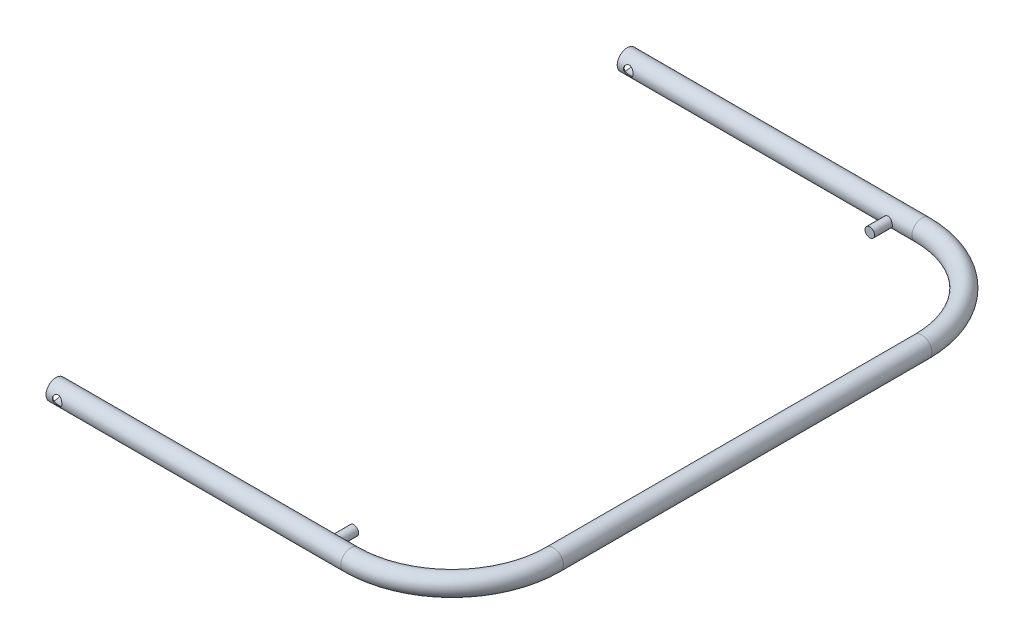
from build123d import *

# Parameters (mm, degrees)
SKETCH2_R                = 13.5
SKETCH2_R_2              = 12.5
SKETCH11_R               = 6.5
CUT_EXTRUDE1_DEPTH       = 516.5
BOSS_EXTRUDE1_REACH      = 933.549
BOSS_EXTRUDE1_END_RADIUS = 13.5
SKETCH12_R               = 6.5
BOSS_EXTRUDE2_REACH      = 933.549
BOSS_EXTRUDE2_END_RADIUS = 13.5
SKETCH13_R               = 6.5


with BuildPart() as part:
    # Sweep-Thin1: sweep along a path in Sketch1
    with BuildLine(Plane(origin=(0, 0, 0), x_dir=(1, 0, 0), z_dir=(0, 1, 0))) as sweep_thin1_path:
        Line((0, 400), (400, 400))
        ThreePointArc((400, 400), (506.066017178, 356.066017178), (550, 250))
        Line((550, 250), (550, -250))
        ThreePointArc((550, -250), (506.066017178, -356.066017178), (400, -400))
        Line((400, -400), (0, -400))
    # Sketch2 → Sweep-Thin1 (sweep)
    with BuildSketch(Plane(origin=(0, 0, -400), x_dir=(0, 0, -1), z_dir=(1, 0, 0))):
        with Locations((-12.5, 0)):
            Circle(SKETCH2_R)
        with Locations((-12.5, 0)):
            Circle(SKETCH2_R_2, mode=Mode.SUBTRACT)
    sweep(path=sweep_thin1_path.line)

    # Sketch11 → Cut-Extrude1 (cut, symmetric)
    with BuildSketch(Plane.XY):
        with Locations((15, 0)):
            Circle(SKETCH11_R)
    extrude(amount=CUT_EXTRUDE1_DEPTH, both=True, mode=Mode.SUBTRACT)

    # Boss-Extrude1: up to this cylinder (the profile starts outside it)
    boss_extrude1_end = Plane(origin=(366.731062, 0, -387.5), z_dir=(1, 0, 0)) * Cylinder(BOSS_EXTRUDE1_END_RADIUS, 1895.098, mode=Mode.PRIVATE)
    # Sketch12 → Boss-Extrude1 (add, up to the surface)
    with BuildSketch(Plane.XY.offset(-350), mode=Mode.PRIVATE) as boss_extrude1_sk1:
        with Locations((366.731061819, -1.317670837)):
            Circle(SKETCH12_R)
    boss_extrude1_tool1 = extrude(boss_extrude1_sk1.sketch, amount=-BOSS_EXTRUDE1_REACH, mode=Mode.PRIVATE) - boss_extrude1_end
    add(boss_extrude1_tool1.solids().sort_by_distance((366.731062, -1.317671, -350))[0])

    # Boss-Extrude2: up to this cylinder (the profile starts outside it)
    boss_extrude2_end = Plane(origin=(366.731062, 0, 387.5), z_dir=(-1, 0, 0)) * Cylinder(BOSS_EXTRUDE2_END_RADIUS, 1895.098, mode=Mode.PRIVATE)
    # Sketch13 → Boss-Extrude2 (add, up to the surface)
    with BuildSketch(Plane.XY.offset(350), mode=Mode.PRIVATE) as boss_extrude2_sk1:
        with Locations((366.731061819, -1.317670837)):
            Circle(SKETCH13_R)
    boss_extrude2_tool1 = extrude(boss_extrude2_sk1.sketch, amount=BOSS_EXTRUDE2_REACH, mode=Mode.PRIVATE) - boss_extrude2_end
    add(boss_extrude2_tool1.solids().sort_by_distance((366.731062, -1.317671, 350))[0])


solid = part.part
